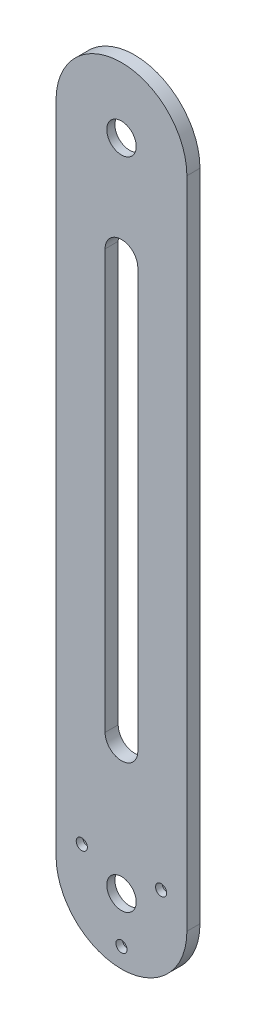
from build123d import *

# Parameters (mm, degrees)
SKETCH_1_R          = 8.75
EXTRUDE_1_DEPTH     = 4
EXTRUDE_START       = -2.5
SKETCH_3_R          = 8.75
SKETCH_3_R_2        = 4.5
EXTRUDE_2_DEPTH     = 2.5
CUT_EXTRUDE_2_DEPTH = 221.943431674
SKETCH_4_R          = 1.7
CUT_EXTRUDE_3_DEPTH = 221.943431674
SKETCH_5_R          = 3
CUT_EXTRUDE_4_DEPTH = 2


with BuildPart() as part:
    # 草图1 → 凸台-拉伸1 (new body)
    with BuildSketch(Plane.XY):
        with BuildLine():
            Line((-20, 0), (-20, -200))
            ThreePointArc((-20, -200), (0, -220), (20, -200))
            Line((20, -200), (20, 0))
            ThreePointArc((20, 0), (0, 20), (-20, 0))
        make_face()
        Circle(SKETCH_1_R, mode=Mode.SUBTRACT)
        with Locations((0, -200)):
            Circle(SKETCH_1_R, mode=Mode.SUBTRACT)
    extrude(amount=EXTRUDE_1_DEPTH)

    # 草图3 → 凸台-拉伸2 (add)
    # profile 1 of 2: a face of its own
    with BuildSketch(Plane.XY.offset(4).offset(EXTRUDE_START)):
        Circle(SKETCH_3_R)
        Circle(SKETCH_3_R_2, mode=Mode.SUBTRACT)
    # profile 2 of 2: a face of its own
    with BuildSketch(Plane.XY.offset(4).offset(EXTRUDE_START)):
        with Locations((0, -200)):
            Circle(SKETCH_3_R)
        with Locations((0, -200)):
            Circle(SKETCH_3_R_2, mode=Mode.SUBTRACT)
    extrude(amount=EXTRUDE_2_DEPTH)

    # 草图2 → 切除-拉伸2 (cut, through all)
    with BuildSketch(Plane.XY.offset(4)):
        with BuildLine():
            Line((-5, -31.845004689), (-5, -159.845004689))
            ThreePointArc((-5, -159.845004689), (0, -164.845004689), (5, -159.845004689))
            Line((5, -159.845004689), (5, -31.845004689))
            ThreePointArc((5, -31.845004689), (0, -26.845004689), (-5, -31.845004689))
        make_face()
    extrude(amount=-CUT_EXTRUDE_2_DEPTH, mode=Mode.SUBTRACT)

    # 草图4 → 切除-拉伸3 (cut, through all)
    with BuildSketch(Plane(origin=(0, 0, 0), x_dir=(-1, 0, 0), z_dir=(0, 0, -1))):
        with Locations((0, -214)):
            Circle(SKETCH_4_R)
        with Locations((-12.124355653, -193)):
            Circle(SKETCH_4_R)
        with Locations((12.124355653, -193)):
            Circle(SKETCH_4_R)
    extrude(amount=-CUT_EXTRUDE_3_DEPTH, mode=Mode.SUBTRACT)

    # 草图5 → 切除-拉伸4 (cut)
    with BuildSketch(Plane(origin=(0, 0, 0), x_dir=(-1, 0, 0), z_dir=(0, 0, -1))):
        with Locations((-12.124355653, -193)):
            Circle(SKETCH_5_R)
        with Locations((12.124355653, -193)):
            Circle(SKETCH_5_R)
        with Locations((0, -214)):
            Circle(SKETCH_5_R)
    extrude(amount=-CUT_EXTRUDE_4_DEPTH, mode=Mode.SUBTRACT)


solid = part.part
